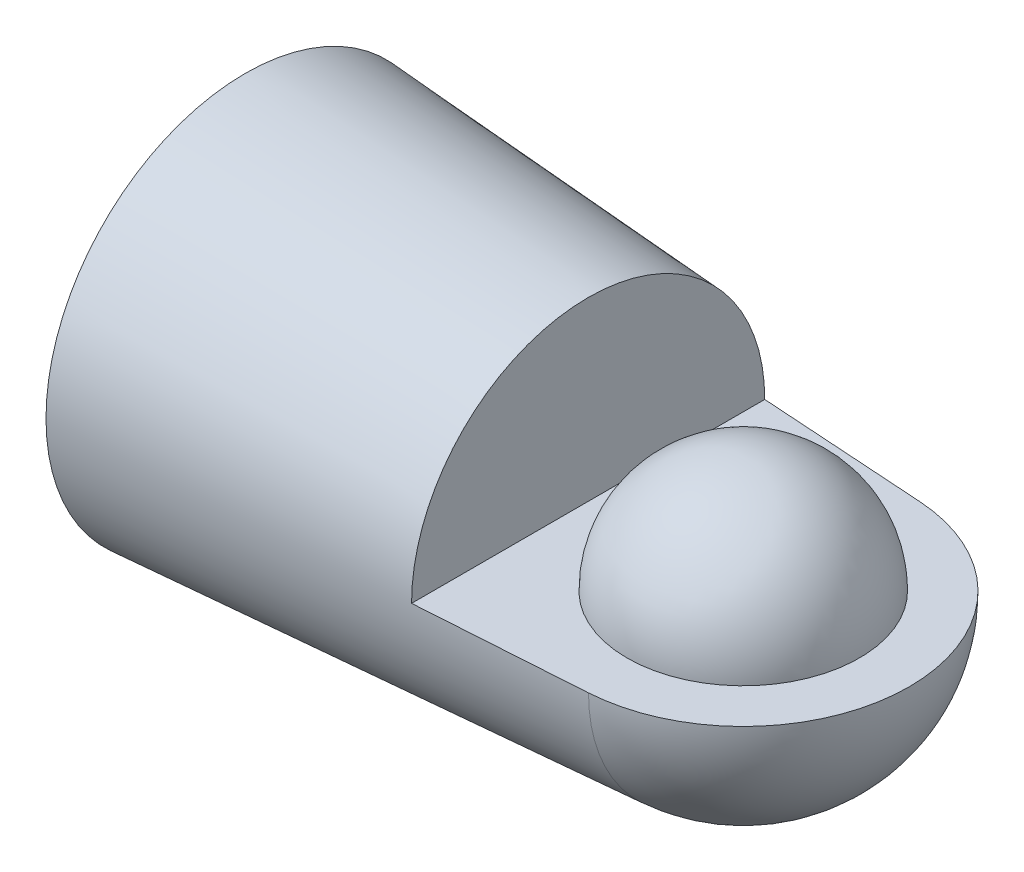
from build123d import *

# Parameters (mm, degrees)
SKETCH2_W          = 100
SKETCH2_H          = 120
CUT_EXTRUDE1_DEPTH = 82
SKETCH4_R          = 50
CUT_EXTRUDE2_DEPTH = 20


with BuildPart() as part:
    # Sketch1 → Revolve1 (revolve)
    with BuildSketch(Plane(origin=(0, 0, 0), x_dir=(1, 0, 0), z_dir=(0, 1, 0)), mode=Mode.PRIVATE) as revolve1_sk:
        with BuildLine():
            Line((0, 0), (-150, 0))
            Line((-150, 0), (-150, 60))
            Line((-150, 60), (3.289990225, 49.891642229))
            ThreePointArc((3.289990225, 49.891642229), (36.499996652, 34.172360825), (50, 0))
            Line((50, 0), (0, 0))
        make_face()
    revolve(revolve1_sk.sketch.rotate(Axis((0, 0, 0), (-1, 0, 0)), 180), axis=Axis((0, 0, 0), (-1, 0, 0)))

    # Sketch2 → Cut-Extrude1 (cut)
    with BuildSketch(Plane(origin=(0, 0, 0), x_dir=(1, 0, 0), z_dir=(0, 1, 0))):
        with Locations((3.289990225, 0)):
            Rectangle(SKETCH2_W, SKETCH2_H)
    extrude(amount=CUT_EXTRUDE1_DEPTH, mode=Mode.SUBTRACT)

    # Sketch3 → Revolve2 (revolve)
    with BuildSketch(Plane(origin=(0, 0, 0), x_dir=(1, 0, 0), z_dir=(0, 1, 0))):
        with BuildLine():
            Line((-35, 0), (35, 0))
            ThreePointArc((35, 0), (0, 35), (-35, 0))
        make_face()
    revolve(axis=Axis((-35, 0, 0), (1, 0, 0)))

    # Sketch4 → Cut-Extrude2 (cut)
    with BuildSketch(Plane.ZY.offset(150)):
        Circle(SKETCH4_R)
    extrude(amount=-CUT_EXTRUDE2_DEPTH, mode=Mode.SUBTRACT)


solid = part.part
